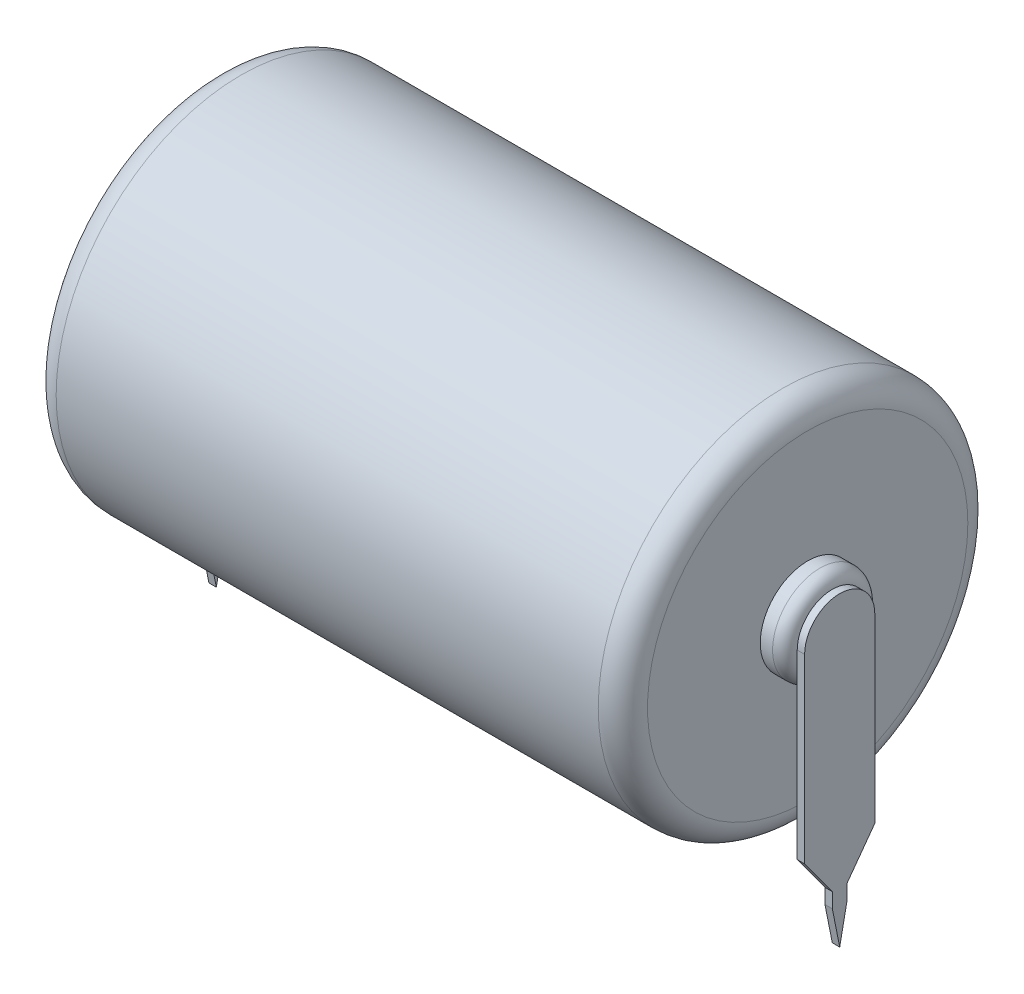
from build123d import *

# Parameters (mm, degrees)
SKETCH1_R           = 7.5
BOSS_EXTRUDE1_DEPTH = 24
FILLET1_R           = 1
SKETCH2_R           = 1.924270806
BOSS_EXTRUDE2_DEPTH = 1
FILLET2_R           = 0.5
SKETCH3_R           = 5.477488552
SKETCH3_R_2         = 5.118293918
CUT_EXTRUDE1_DEPTH  = 0.3
BOSS_EXTRUDE3_DEPTH = 0.3
BOSS_EXTRUDE4_START = 0.3
BOSS_EXTRUDE4_DEPTH = 0.3


with BuildPart() as part:
    # Sketch1 → Boss-Extrude1 (new body)
    with BuildSketch(Plane(origin=(0, 0, 0), x_dir=(0, 0, -1), z_dir=(1, 0, 0))):
        Circle(SKETCH1_R)
    extrude(amount=BOSS_EXTRUDE1_DEPTH)

    # Fillet1
    fillet1_edges = [part.edges().sort_by_distance(p)[0] for p in [
        (0, 0, 7.5),
        (24, 0, 7.5),
    ]]
    fillet(fillet1_edges, radius=FILLET1_R)

    # Sketch2 → Boss-Extrude2 (add)
    with BuildSketch(Plane(origin=(24, 0, 0), x_dir=(0, 0, -1), z_dir=(1, 0, 0))):
        Circle(SKETCH2_R)
    extrude(amount=BOSS_EXTRUDE2_DEPTH)

    # Fillet2
    fillet2_edges = [part.edges().sort_by_distance(p)[0] for p in [
        (25, 0, 1.924270806),
    ]]
    fillet(fillet2_edges, radius=FILLET2_R)

    # Sketch3 → Cut-Extrude1 (cut)
    with BuildSketch(Plane.ZY):
        Circle(SKETCH3_R)
        Circle(SKETCH3_R_2, mode=Mode.SUBTRACT)
    extrude(amount=-CUT_EXTRUDE1_DEPTH, mode=Mode.SUBTRACT)

    # Sketch4 → Boss-Extrude3 (add)
    with BuildSketch(Plane(origin=(25, 0, 0), x_dir=(0, 0, -1), z_dir=(1, 0, 0))):
        with BuildLine():
            Line((-1.424270806, 0), (-1.424270806, -7.363521757))
            Line((-1.424270806, -7.363521757), (-0.511928366, -8.610369315))
            Line((-0.511928366, -8.610369315), (-0.3, -8.9))
            Line((-0.3, -8.9), (-0.3, -9.5))
            Line((-0.3, -9.5), (0, -11))
            Line((0, -11), (0.3, -9.5))
            Line((0.3, -9.5), (0.3, -8.9))
            Line((0.3, -8.9), (0.520522804, -8.598623776))
            Line((0.520522804, -8.598623776), (1.424270806, -7.363521757))
            Line((1.424270806, -7.363521757), (1.424270806, 0))
            ThreePointArc((1.424270806, 0), (0, 1.424270806), (-1.424270806, 0))
        make_face()
    extrude(amount=BOSS_EXTRUDE3_DEPTH)

    # Sketch5 → Boss-Extrude4 (add)
    with BuildSketch(Plane.ZY.offset(BOSS_EXTRUDE4_START)):
        with BuildLine():
            Line((-0.3, -8.9), (-0.3, -9.5))
            Line((-0.3, -9.5), (0, -11))
            Line((0, -11), (0.3, -9.5))
            Line((0.3, -9.5), (0.3, -8.9))
            Line((0.3, -8.9), (0.511928366, -8.610369315))
            Line((0.511928366, -8.610369315), (1.424270806, -7.363521757))
            Line((1.424270806, -7.363521757), (1.424270806, 0))
            ThreePointArc((1.424270806, 0), (0, 1.424270806), (-1.424270806, 0))
            Line((-1.424270806, 0), (-1.424270806, -7.363521757))
            Line((-1.424270806, -7.363521757), (-0.520522804, -8.598623776))
            Line((-0.520522804, -8.598623776), (-0.3, -8.9))
        make_face()
    extrude(amount=-BOSS_EXTRUDE4_DEPTH)


solid = part.part
